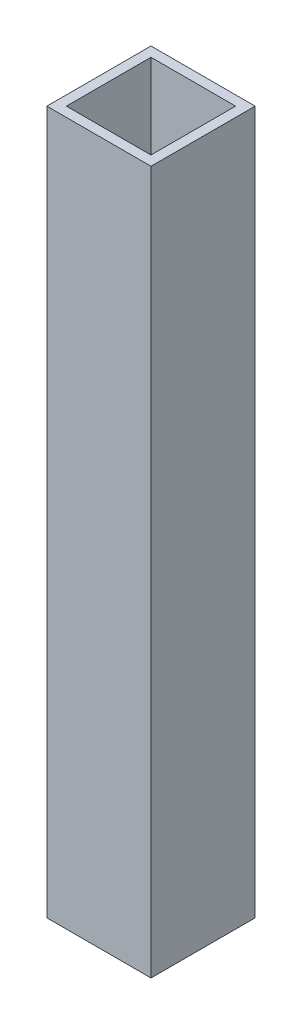
from build123d import *

# Parameters (mm, degrees)
SKETCH1_W           = 50.8
SKETCH1_H           = 342.9
BOSS_EXTRUDE1_DEPTH = 50.8
CUT_EXTRUDE1_REACH  = 349.572
SKETCH3_W           = 41.275
SKETCH3_H           = 41.275


with BuildPart() as part:
    # Sketch1 → Boss-Extrude1 (new body)
    with BuildSketch(Plane.XY):
        Rectangle(SKETCH1_W, SKETCH1_H)
    extrude(amount=BOSS_EXTRUDE1_DEPTH)

    # Sketch3 → Cut-Extrude1 (cut, up to next)
    with BuildSketch(Plane(origin=(0, 171.45, 0), x_dir=(1, 0, 0), z_dir=(0, 1, 0)), mode=Mode.PRIVATE) as cut_extrude1_sk1:
        with Locations((0, -25.4)):
            Rectangle(SKETCH3_W, SKETCH3_H)
    cut_extrude1_tool1 = extrude(cut_extrude1_sk1.sketch, amount=-CUT_EXTRUDE1_REACH, mode=Mode.PRIVATE) & part.part
    add(cut_extrude1_tool1.solids().sort_by_distance((0, 171.45, 25.4))[0], mode=Mode.SUBTRACT)


solid = part.part
